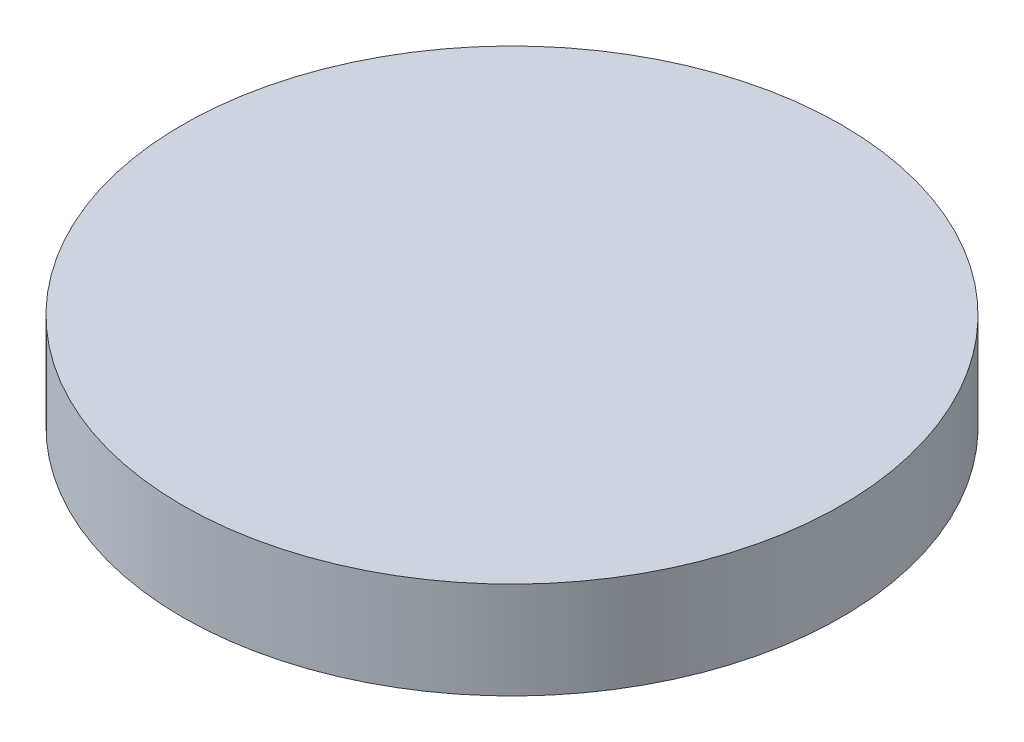
from build123d import *

# Parameters (mm, degrees)
SKETCH1_R           = 81.64426266
BOSS_EXTRUDE1_DEPTH = 24


with BuildPart() as part:
    # Sketch1 → Boss-Extrude1 (new body)
    with BuildSketch(Plane(origin=(0, 0, 0), x_dir=(1, 0, 0), z_dir=(0, 1, 0))):
        with Locations(Location((-21.442610965, 0, 0), (0, 0, 270))):
            Circle(SKETCH1_R)
    extrude(amount=BOSS_EXTRUDE1_DEPTH)


solid = part.part
